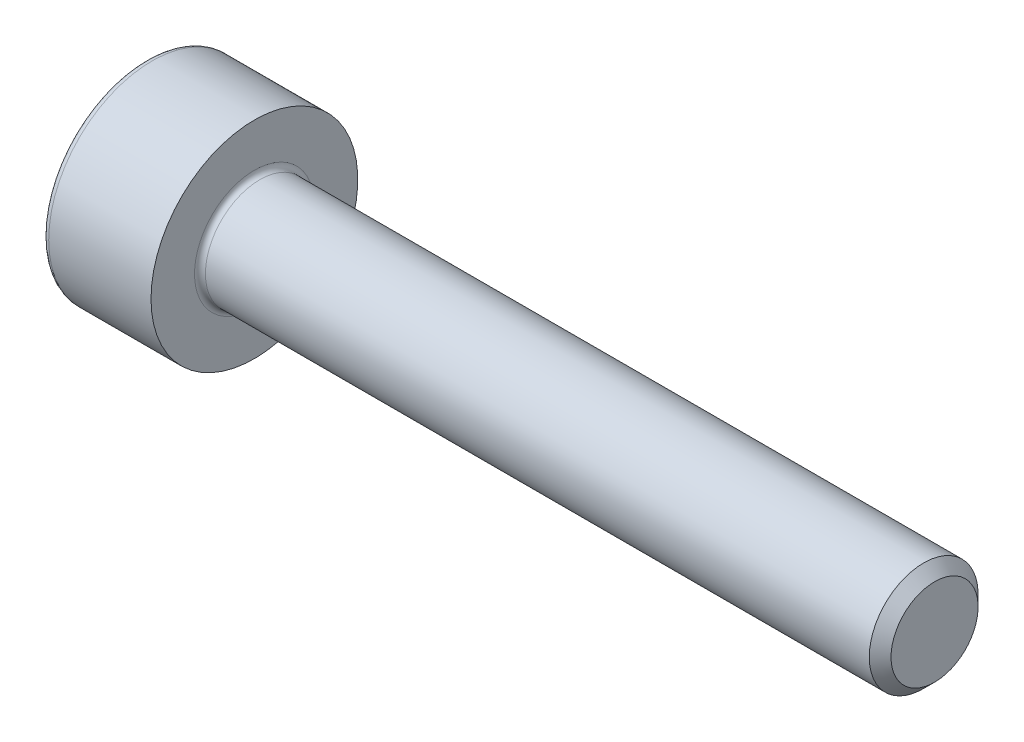
from build123d import *

# Parameters (mm, degrees)
FILLET1_R      = 0.1
FILLET2_R      = 0.12
CHAMFER1_SIZE  = 0.2
EXTRUDE1_DEPTH = 1


with BuildPart() as part:
    # Sketch1 → Revolve1 (revolve)
    with BuildSketch(Plane.XY, mode=Mode.PRIVATE) as revolve1_sk:
        Polygon((2, 1), (2, 0), (4.279914881, 0), (14.5, 0), (14.5, 1), align=None)
        Polygon((0, 1.9), (0, 0), (2, 0), (2, 1), (2, 1.9), align=None)
    revolve(revolve1_sk.sketch.rotate(Axis((0, 0, 0), (1, 0, 0)), 90), axis=Axis((0, 0, 0), (1, 0, 0)))

    # Fillet1
    fillet1_edges = [part.edges().sort_by_distance(p)[0] for p in [
        (2, 0, -1),
    ]]
    fillet(fillet1_edges, radius=FILLET1_R)

    # Fillet2
    fillet2_edges = [part.edges().sort_by_distance(p)[0] for p in [
        (0, 0, -1.9),
    ]]
    fillet(fillet2_edges, radius=FILLET2_R)

    # Chamfer1
    chamfer1_edges = [part.edges().sort_by_distance(p)[0] for p in [
        (14.5, 0, -1),
    ]]
    chamfer(chamfer1_edges, length=CHAMFER1_SIZE)

    # Sketch2 → Extrude1 (cut)
    with BuildSketch(Plane.ZY):
        Polygon((0, 0.866025404), (-0.75, 0.433012702), (-0.75, -0.433012702), (0, -0.866025404), (0.75, -0.433012702), (0.75, 0.433012702), align=None)
    extrude(amount=-EXTRUDE1_DEPTH, mode=Mode.SUBTRACT)


solid = part.part
